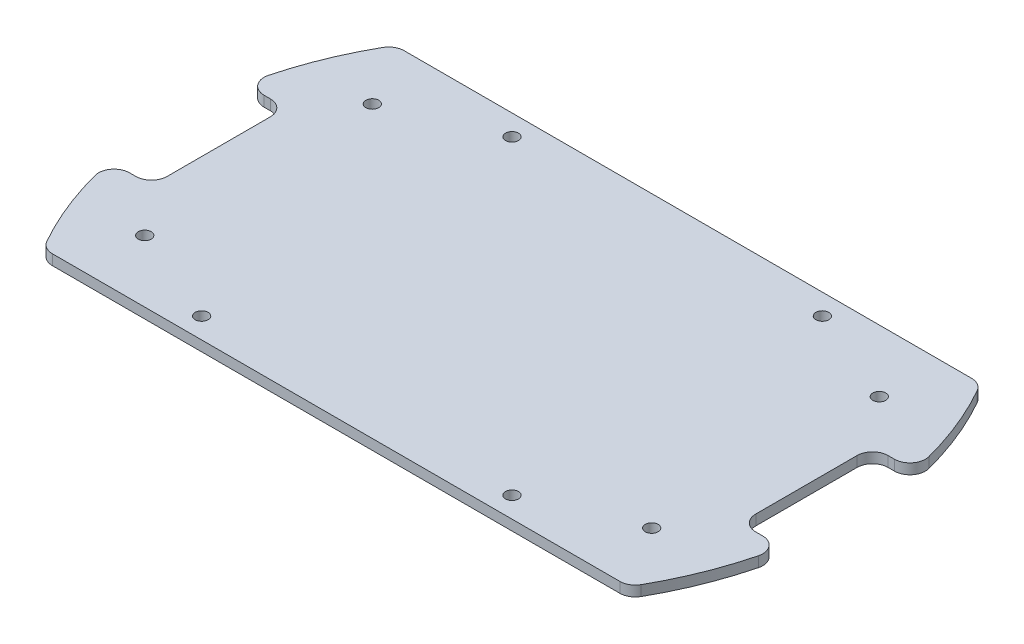
from build123d import *

# Parameters (mm, degrees)
EXTRUDE_2_DEPTH             = 2
M3X0_5_1_D                  = 2.5
M3X0_5_1_DEPTH              = 4
M3X0_5_1_TIP                = 0.751075774
M3X0_5_1_ON_FACE_2_D        = 2.5
M3X0_5_1_ON_FACE_2_DEPTH    = 4
M3X0_5_1_ON_FACE_2_TIP      = 0.751075774
PATTERN_LINEAR_1_COUNT      = 2
PATTERN_LINEAR_1_PITCH      = 98
PATTERN_LINEAR_1_COUNT_DIR2 = 2
PATTERN_LINEAR_1_PITCH_DIR2 = 44
FILLET_4_R                  = 3


with BuildPart() as part:
    # 草圖10 → 填料-伸長2 (new body)
    with BuildSketch(Plane(origin=(0, 0, 0), x_dir=(1, 0, 0), z_dir=(0, 1, 0))):
        with BuildLine():
            Line((56.568542495, 34), (-56.568542495, 34))
            ThreePointArc((-56.568542495, 34), (-61.540159626, 23.849711805), (-64.707032075, 13))
            Line((-64.707032075, 13), (-56.707032075, 13))
            Line((-56.707032075, 13), (-56.707032075, -12.973279994))
            Line((-56.707032075, -12.973279994), (-64.707032075, -13))
            ThreePointArc((-64.707032075, -13), (-61.540159626, -23.849711805), (-56.568542495, -34))
            Line((-56.568542495, -34), (56.568542495, -34))
            ThreePointArc((56.568542495, -34), (61.619473981, -23.644035746), (64.792427449, -12.567471713))
            Line((64.792427449, -12.567471713), (56.707032075, -12.594476939))
            Line((56.707032075, -12.594476939), (56.707032075, 13))
            Line((56.707032075, 13), (64.707032075, 13))
            ThreePointArc((64.707032075, 13), (61.540159626, 23.849711805), (56.568542495, 34))
        make_face()
    extrude(amount=EXTRUDE_2_DEPTH)

    # M3x0.5  螺絲攻的螺孔鑽1
    with Locations(Plane(origin=(30, 2, 30), x_dir=(0, 0, 1), z_dir=(0, 1, 0))):
        with Locations((0, 0), (-60, -60), (0, -60), (-60, 0)):
            Hole(M3X0_5_1_D / 2, depth=M3X0_5_1_DEPTH)
            with Locations((0, 0, -(M3X0_5_1_DEPTH + M3X0_5_1_TIP / 2))):  # 118° drill point
                Cone(0, M3X0_5_1_D / 2, M3X0_5_1_TIP, mode=Mode.SUBTRACT)

    # M3x0.5  螺絲攻的螺孔鑽1 on face 2
    with Locations(Plane(origin=(-30, 0, -30), x_dir=(0, 0, -1), z_dir=(0, -1, 0))):
        with Locations((0, 0)):
            Hole(M3X0_5_1_ON_FACE_2_D / 2, depth=M3X0_5_1_ON_FACE_2_DEPTH)
            with Locations((0, 0, -(M3X0_5_1_ON_FACE_2_DEPTH + M3X0_5_1_ON_FACE_2_TIP / 2))):  # 118° drill point
                Cone(0, M3X0_5_1_ON_FACE_2_D / 2, M3X0_5_1_ON_FACE_2_TIP, mode=Mode.SUBTRACT)

    # 草圖14 → M3x0.5  螺絲攻的螺孔鑽2 (revolve, cut)
    with BuildSketch(Plane(origin=(-49, 2, -22), x_dir=(0, 0, 1), z_dir=(1, 0, 0))):
        Polygon((0, 0), (0, 4.751075774), (1.25, 4), (1.25, 0), align=None)
    m3x0_5_2 = revolve(axis=Axis((-49, 8.35, -22), (0, -1, 0)), mode=Mode.SUBTRACT)

    # 直線複製排列1: M3x0.5 _2 2 × 2
    with Locations(*[(i * PATTERN_LINEAR_1_PITCH, 0, j * PATTERN_LINEAR_1_PITCH_DIR2) for i in range(PATTERN_LINEAR_1_COUNT) for j in range(PATTERN_LINEAR_1_COUNT_DIR2) if (i, j) != (0, 0)]):
        add(m3x0_5_2, mode=Mode.SUBTRACT)

    # 圓角4
    fillet_4_edges = [part.edges().sort_by_distance(p)[0] for p in [
        (-56.707032075, 1, -13),
        (-64.707032075, 1, -13),
        (-56.568542495, 1, -34),
        (56.568542495, 1, -34),
        (64.707032075, 1, -13),
        (56.707032075, 1, -13),
        (56.707032075, 1, 12.594476939),
        (64.792427449, 1, 12.567471713),
        (56.568542495, 1, 34),
        (-56.568542495, 1, 34),
        (-64.707032075, 1, 13),
        (-56.707032075, 1, 12.973279994),
    ]]
    fillet(fillet_4_edges, radius=FILLET_4_R)


solid = part.part
